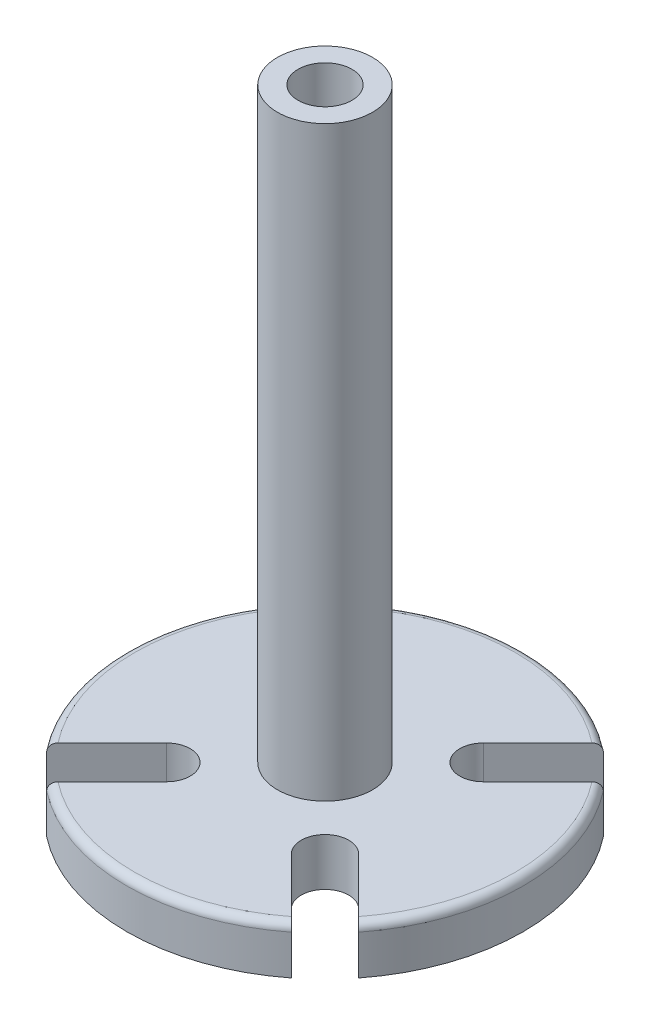
from build123d import *

# Parameters (mm, degrees)
FILLET_1_R             = 1
HOLE_WIZARD_M8_1_D     = 6.8
HOLE_WIZARD_M8_1_DEPTH = 20
HOLE_WIZARD_M8_1_TIP   = 2.042926105
CUT_EXTRUDE_1_DEPTH    = 83.012194246


with BuildPart() as part:
    # 草图1 → 旋转1 (revolve)
    with BuildSketch(Plane.XY, mode=Mode.PRIVATE) as revolve_1_sk:
        Polygon((0, 0), (0, 80), (-6, 80), (-6, 6), (-25, 6), (-25, 0), align=None)
    revolve(revolve_1_sk.sketch.rotate(Axis((0, 0, 0), (0, 1, 0)), 270), axis=Axis((0, 0, 0), (0, 1, 0)))

    # 圆角1
    fillet_1_edges = [part.edges().sort_by_distance(p)[0] for p in [
        (0, 6, 25),
    ]]
    fillet(fillet_1_edges, radius=FILLET_1_R)

    # M8 螺纹槽口的螺纹槽口钻头1
    with Locations(Plane(origin=(0, 80, 0), x_dir=(1, 0, 0), z_dir=(0, 1, 0))):
        with Locations((0, 0)):
            Hole(HOLE_WIZARD_M8_1_D / 2, depth=HOLE_WIZARD_M8_1_DEPTH)
            with Locations((0, 0, -(HOLE_WIZARD_M8_1_DEPTH + HOLE_WIZARD_M8_1_TIP / 2))):  # 118° drill point
                Cone(0, HOLE_WIZARD_M8_1_D / 2, HOLE_WIZARD_M8_1_TIP, mode=Mode.SUBTRACT)

    # 草图5 → 切除-拉伸1 (cut, through all)
    with BuildSketch(Plane(origin=(0, 6, 0), x_dir=(1, 0, 0), z_dir=(0, 1, 0))):
        with BuildLine():
            Line((12.121320344, -7.878679656), (22.727922061, -18.485281374))
            ThreePointArc((22.727922061, -18.485281374), (22.727922061, -22.727922061), (18.485281374, -22.727922061))
            Line((18.485281374, -22.727922061), (7.878679656, -12.121320344))
            ThreePointArc((7.878679656, -12.121320344), (7.878679656, -7.878679656), (12.121320344, -7.878679656))
        make_face()
        with BuildLine():
            Line((-7.878679656, -12.121320344), (-18.485281374, -22.727922061))
            ThreePointArc((-18.485281374, -22.727922061), (-22.727922061, -22.727922061), (-22.727922061, -18.485281374))
            Line((-22.727922061, -18.485281374), (-12.121320344, -7.878679656))
            ThreePointArc((-12.121320344, -7.878679656), (-7.878679656, -7.878679656), (-7.878679656, -12.121320344))
        make_face()
        with BuildLine():
            Line((-12.121320344, 7.878679656), (-22.727922061, 18.485281374))
            ThreePointArc((-22.727922061, 18.485281374), (-22.727922061, 22.727922061), (-18.485281374, 22.727922061))
            Line((-18.485281374, 22.727922061), (-7.878679656, 12.121320344))
            ThreePointArc((-7.878679656, 12.121320344), (-7.878679656, 7.878679656), (-12.121320344, 7.878679656))
        make_face()
        with BuildLine():
            Line((7.878679656, 12.121320344), (18.485281374, 22.727922061))
            ThreePointArc((18.485281374, 22.727922061), (22.727922061, 22.727922061), (22.727922061, 18.485281374))
            Line((22.727922061, 18.485281374), (12.121320344, 7.878679656))
            ThreePointArc((12.121320344, 7.878679656), (7.878679656, 7.878679656), (7.878679656, 12.121320344))
        make_face()
    extrude(amount=-CUT_EXTRUDE_1_DEPTH, mode=Mode.SUBTRACT)


solid = part.part
